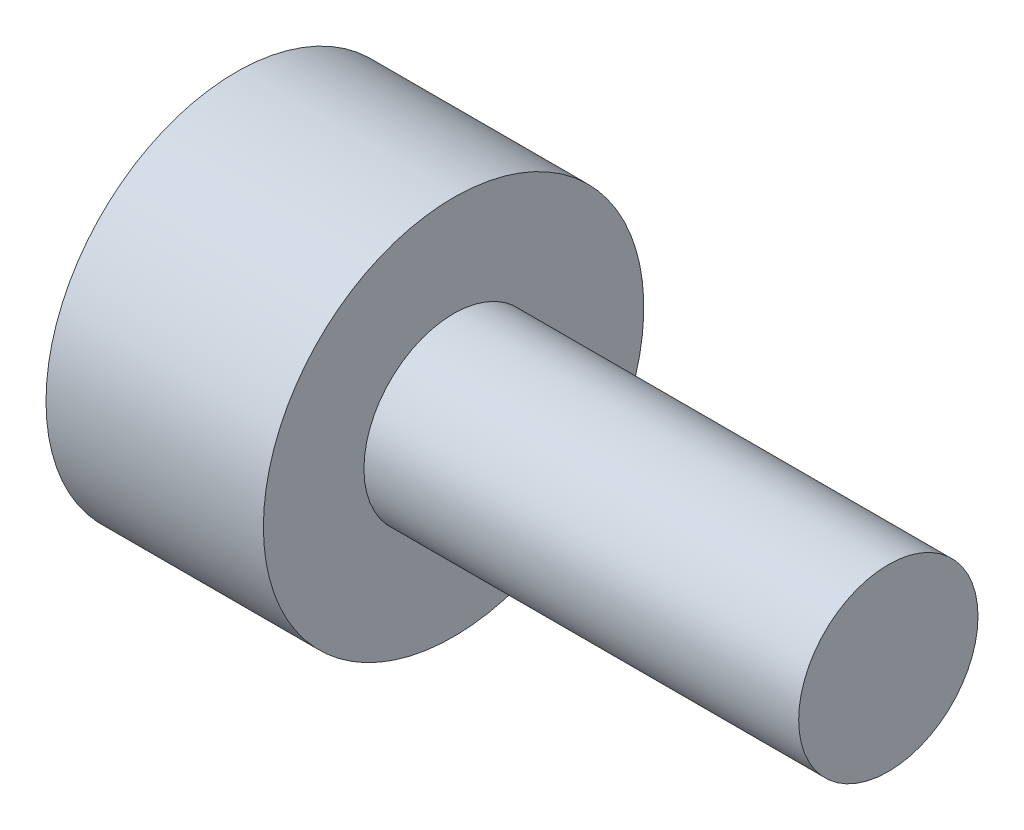
from build123d import *

# Parameters (mm, degrees)
SOCKET_DEPTH = 2


with BuildPart() as part:
    # Screw Sketch → Screw (revolve)
    with BuildSketch(Plane.XY):
        Polygon((-4, 0), (-4, 3.5), (0, 3.5), (0, 1.65), (8, 1.65), (8, 0), align=None)
    revolve(axis=Axis((-1000, 0, 0), (1, 0, 0)))

    # Socket Sketch → Socket (cut)
    with BuildSketch(Plane(origin=(-4, 0, 0), x_dir=(0, 0, -1), z_dir=(1, 0, 0))):
        Polygon((1.732050808, 0), (0.866025404, 1.5), (-0.866025404, 1.5), (-1.732050808, 0), (-0.866025404, -1.5), (0.866025404, -1.5), align=None)
    extrude(amount=SOCKET_DEPTH, mode=Mode.SUBTRACT)


solid = part.part
